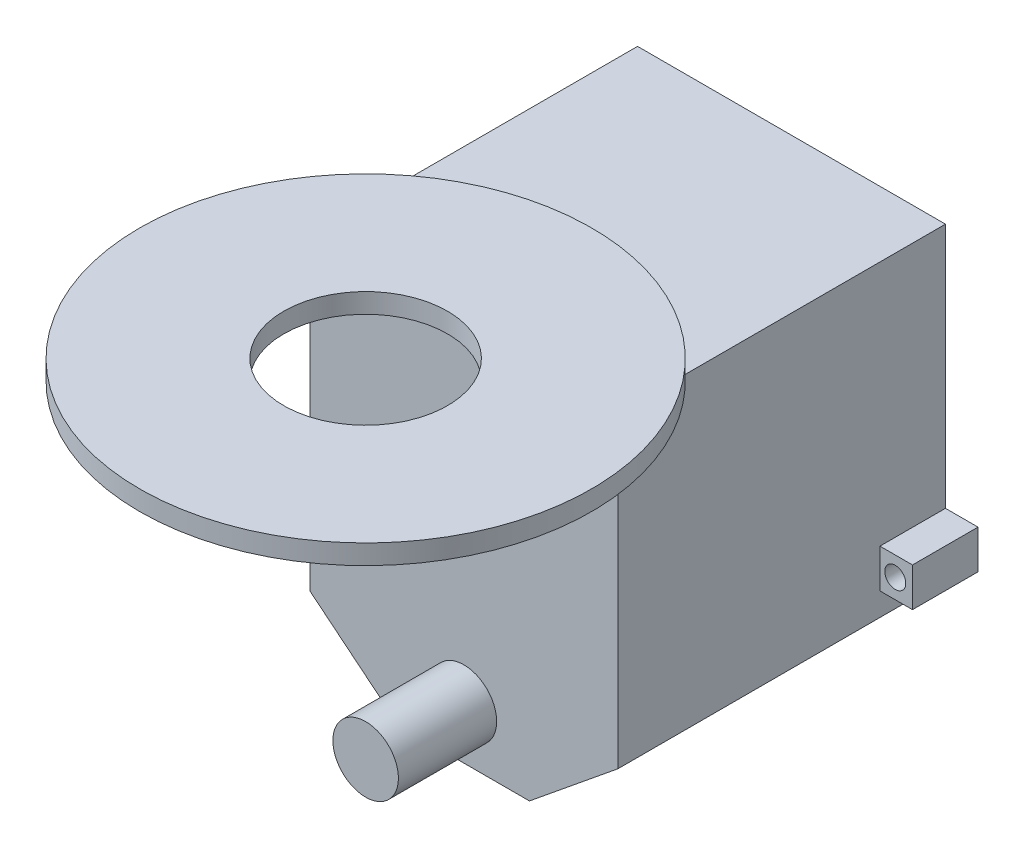
from build123d import *

# Parameters (mm, degrees)
EXTRUDE_1_DEPTH     = 50
CUT_EXTRUDE_1_DEPTH = 48
SKETCH_3_W          = 4.966361877
SKETCH_3_H          = 5.916795771
SKETCH_3_R          = 1.6
EXTRUDE_2_DEPTH     = 10
SKETCH_4_W          = 4.668240674
SKETCH_4_H          = 4.515988468
SKETCH_4_R          = 1.6
EXTRUDE_3_DEPTH     = 10
SKETCH_5_R          = 5
EXTRUDE_4_DEPTH     = 15
SKETCH_8_R          = 34.5
EXTRUDE_6_DEPTH     = 3
SKETCH_9_R          = 12.5
CUT_EXTRUDE_3_DEPTH = 3


with BuildPart() as part:
    # 草图1 → 凸台-拉伸1 (new body)
    with BuildSketch(Plane.XY):
        Polygon((10, 0), (-10, 0), (-23.5, 11), (-23.5, 58), (23.5, 58), (23.5, 11), align=None)
    extrude(amount=EXTRUDE_1_DEPTH)

    # 草图2 → 切除-拉伸1 (cut)
    with BuildSketch(Plane(origin=(0, 0, 0), x_dir=(-1, 0, 0), z_dir=(0, 0, -1))):
        Polygon((9.288350042, 2), (21.5, 11.950233299), (21.5, 56), (-21.5, 56), (-21.5, 11.950233299), (-9.288350042, 2), align=None)
    extrude(amount=-CUT_EXTRUDE_1_DEPTH, mode=Mode.SUBTRACT)

    # 草图3 → 凸台-拉伸2 (add)
    with BuildSketch(Plane(origin=(0, 0, 0), x_dir=(-1, 0, 0), z_dir=(0, 0, -1))):
        with Locations((-25.983180938, 17.476199431)):
            Rectangle(SKETCH_3_W, SKETCH_3_H)
        with Locations((-25.836674867, 17.476199431)):
            Circle(SKETCH_3_R, mode=Mode.SUBTRACT)
    extrude_2 = extrude(amount=-EXTRUDE_2_DEPTH)

    # 镜向1: 凸台-拉伸2 across plane
    add(extrude_2.mirror(Plane(origin=(0, 0, 0), x_dir=(0, 0, 1), z_dir=(1, 0, 0))))

    # 草图5 → 凸台-拉伸4 (add)
    with BuildSketch(Plane.XY.offset(50)):
        with Locations(Location((0, 8, 0), (0, 0, 180))):
            Circle(SKETCH_5_R)
    extrude(amount=EXTRUDE_4_DEPTH)

    # 草图8 → 凸台-拉伸6 (add)
    with BuildSketch(Plane(origin=(0, 58, 0), x_dir=(1, 0, 0), z_dir=(0, 1, 0))):
        with Locations(Location((0, -65, 0), (0, 0, 47.065689197))):
            Circle(SKETCH_8_R)
    extrude(amount=EXTRUDE_6_DEPTH)

    # 草图9 → 切除-拉伸3 (cut)
    with BuildSketch(Plane(origin=(0, 61, 0), x_dir=(1, 0, 0), z_dir=(0, 1, 0))):
        with Locations(Location((0, -65, 0), (0, 0, 180))):
            Circle(SKETCH_9_R)
    extrude(amount=-CUT_EXTRUDE_3_DEPTH, mode=Mode.SUBTRACT)


with BuildPart() as body_2:
    # 草图4 → 凸台-拉伸3 (new body)
    with BuildSketch(Plane(origin=(0, 0, 0), x_dir=(-1, 0, 0), z_dir=(0, 0, -1))):
        with Locations((0.920796605, -2.257994234)):
            Rectangle(SKETCH_4_W, SKETCH_4_H)
        with Locations((1.161292115, -2.326519441)):
            Circle(SKETCH_4_R, mode=Mode.SUBTRACT)
    extrude(amount=-EXTRUDE_3_DEPTH)


solid = Compound([part.part, body_2.part])
